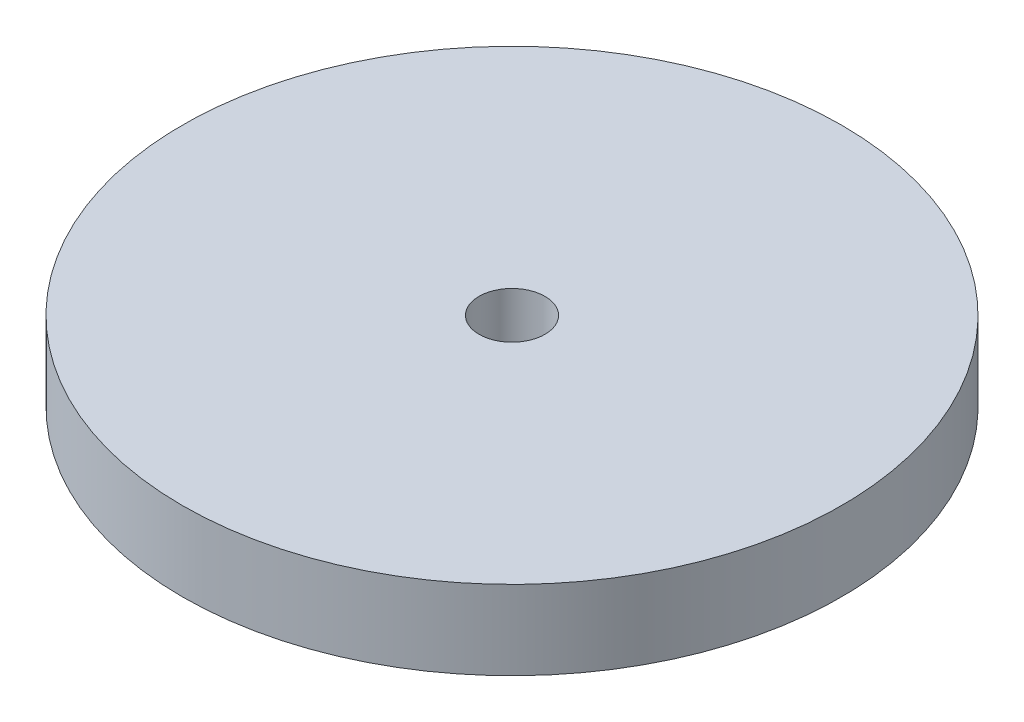
from build123d import *

# Parameters (mm, degrees)
SKETCH1_R           = 125
SKETCH1_R_2         = 12.5
BOSS_EXTRUDE1_DEPTH = 15


with BuildPart() as part:
    # Sketch1 → Boss-Extrude1 (new, symmetric)
    with BuildSketch(Plane(origin=(0, 0, 0), x_dir=(1, 0, 0), z_dir=(0, 1, 0))):
        with Locations(Location((0, 0, 0), (0, 0, 270))):
            Circle(SKETCH1_R)
        with Locations(Location((0, 0, 0), (0, 0, 270))):
            Circle(SKETCH1_R_2, mode=Mode.SUBTRACT)
    extrude(amount=BOSS_EXTRUDE1_DEPTH, both=True)


solid = part.part
